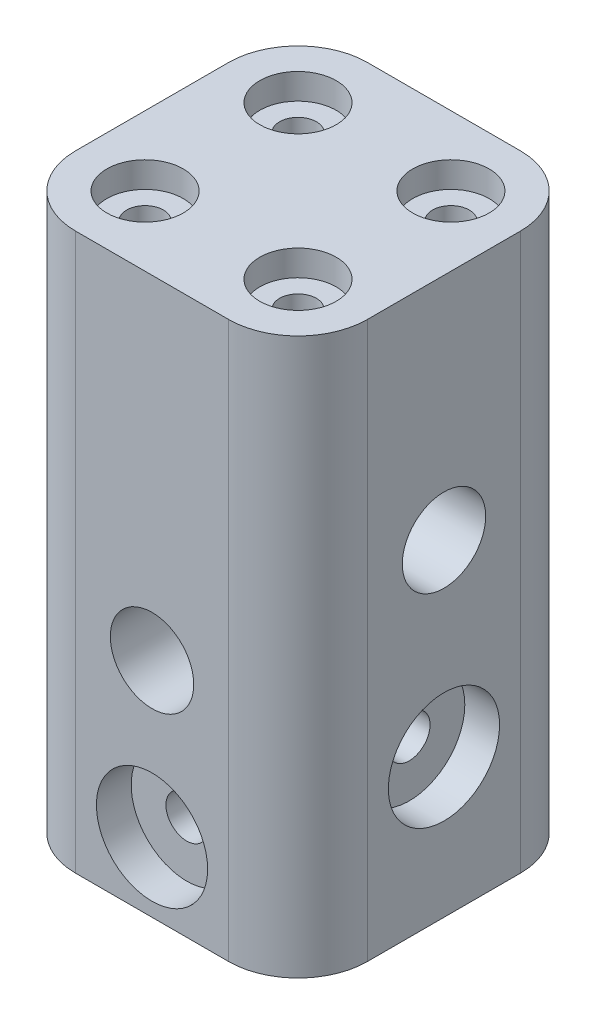
from build123d import *

# Parameters (mm, degrees)
SKETCH1_W                                        = 42
SKETCH1_H                                        = 42
BOSS_EXTRUDE1_DEPTH                              = 80
SKETCH2_R                                        = 6
CUT_EXTRUDE1_DEPTH                               = 93.763139231
SKETCH3_R                                        = 6
CUT_EXTRUDE2_DEPTH                               = 93.763139231
SKETCH4_R                                        = 3
CUT_EXTRUDE3_DEPTH                               = 93.763139231
SKETCH5_R                                        = 8
CUT_EXTRUDE4_DEPTH                               = 5
CUT_EXTRUDE5_START                               = -5
SKETCH6_R                                        = 8
CUT_EXTRUDE5_DEPTH                               = 5
SKETCH7_R                                        = 3
CUT_EXTRUDE6_DEPTH                               = 93.763139231
SKETCH8_R                                        = 8
CUT_EXTRUDE7_DEPTH                               = 5
CUT_EXTRUDE8_START                               = -5
SKETCH9_R                                        = 8
CUT_EXTRUDE8_DEPTH                               = 5
FILLET1_R                                        = 10
CBORE_FOR_M5_PAN_HEAD_MACHINE_SCREW1_D           = 5.3
CBORE_FOR_M5_PAN_HEAD_MACHINE_SCREW1_CBORE_D     = 11
CBORE_FOR_M5_PAN_HEAD_MACHINE_SCREW1_CBORE_DEPTH = 3.7


with BuildPart() as part:
    # Sketch1 → Boss-Extrude1 (new body)
    with BuildSketch(Plane(origin=(0, 0, 0), x_dir=(1, 0, 0), z_dir=(0, 1, 0))):
        Rectangle(SKETCH1_W, SKETCH1_H)
    extrude(amount=BOSS_EXTRUDE1_DEPTH)

    # Sketch2 → Cut-Extrude1 (cut, through all)
    with BuildSketch(Plane.XY.offset(21)):
        with Locations((0, 32)):
            Circle(SKETCH2_R)
    extrude(amount=-CUT_EXTRUDE1_DEPTH, mode=Mode.SUBTRACT)

    # Sketch3 → Cut-Extrude2 (cut, through all)
    with BuildSketch(Plane(origin=(21, 0, 0), x_dir=(0, 0, -1), z_dir=(1, 0, 0))):
        with Locations((0, 47)):
            Circle(SKETCH3_R)
    extrude(amount=-CUT_EXTRUDE2_DEPTH, mode=Mode.SUBTRACT)

    # Sketch4 → Cut-Extrude3 (cut, through all)
    with BuildSketch(Plane.XY.offset(21)):
        with Locations((0, 10)):
            Circle(SKETCH4_R)
    extrude(amount=-CUT_EXTRUDE3_DEPTH, mode=Mode.SUBTRACT)

    # Sketch5 → Cut-Extrude4 (cut)
    with BuildSketch(Plane.XY.offset(21)):
        with Locations((0, 10)):
            Circle(SKETCH5_R)
    extrude(amount=-CUT_EXTRUDE4_DEPTH, mode=Mode.SUBTRACT)

    # Sketch6 → Cut-Extrude5 (cut)
    with BuildSketch(Plane(origin=(0, 0, -21), x_dir=(-1, 0, 0), z_dir=(0, 0, -1)).offset(CUT_EXTRUDE5_START)):
        with Locations(Location((0, 10, 0), (0, 0, 180))):
            Circle(SKETCH6_R)
    extrude(amount=CUT_EXTRUDE5_DEPTH, mode=Mode.SUBTRACT)

    # Sketch7 → Cut-Extrude6 (cut, through all)
    with BuildSketch(Plane(origin=(21, 0, 0), x_dir=(0, 0, -1), z_dir=(1, 0, 0))):
        with Locations((0, 20)):
            Circle(SKETCH7_R)
    extrude(amount=-CUT_EXTRUDE6_DEPTH, mode=Mode.SUBTRACT)

    # Sketch8 → Cut-Extrude7 (cut)
    with BuildSketch(Plane(origin=(21, 0, 0), x_dir=(0, 0, -1), z_dir=(1, 0, 0))):
        with Locations((0, 20)):
            Circle(SKETCH8_R)
    extrude(amount=-CUT_EXTRUDE7_DEPTH, mode=Mode.SUBTRACT)

    # Sketch9 → Cut-Extrude8 (cut)
    with BuildSketch(Plane.ZY.offset(21).offset(CUT_EXTRUDE8_START)):
        with Locations(Location((0, 20, 0), (0, 0, 180))):
            Circle(SKETCH9_R)
    extrude(amount=CUT_EXTRUDE8_DEPTH, mode=Mode.SUBTRACT)

    # Fillet1
    fillet1_edges = [part.edges().sort_by_distance(p)[0] for p in [
        (21, 40, 21),
        (-21, 40, 21),
        (-21, 40, -21),
        (21, 40, -21),
    ]]
    fillet(fillet1_edges, radius=FILLET1_R)

    # CBORE for M5 Pan Head Machine Screw1 (through all)
    with Locations(Plane(origin=(0, 80, 0), x_dir=(1, 0, 0), z_dir=(0, 1, 0))):
        with Locations((-11, 11), (11, 11), (11, -11), (-11, -11)):
            CounterBoreHole(CBORE_FOR_M5_PAN_HEAD_MACHINE_SCREW1_D / 2, CBORE_FOR_M5_PAN_HEAD_MACHINE_SCREW1_CBORE_D / 2, CBORE_FOR_M5_PAN_HEAD_MACHINE_SCREW1_CBORE_DEPTH)


solid = part.part
